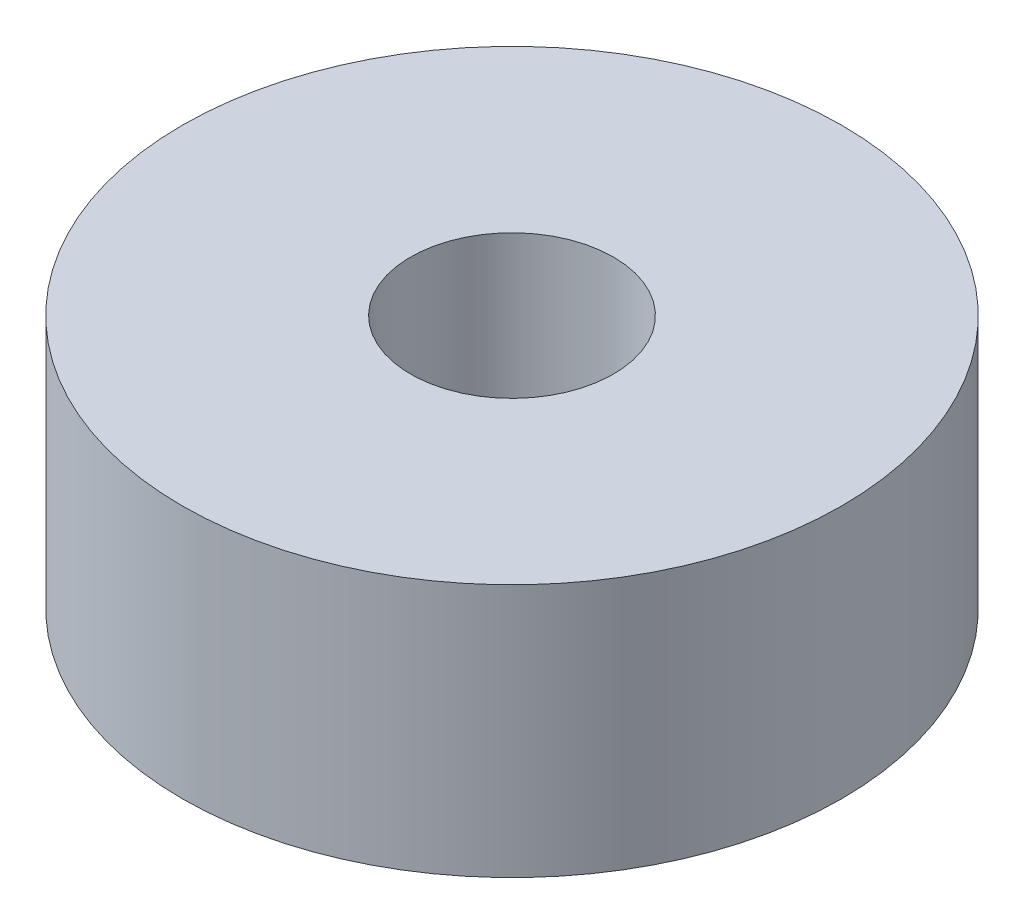
from build123d import *

# Parameters (mm, degrees)
ESQUISSE1_W = 4.5
ESQUISSE1_H = 5


with BuildPart() as part:
    # Esquisse1 → Révolution1 (revolve)
    with BuildSketch(Plane.XY, mode=Mode.PRIVATE) as r_volution1_sk:
        with Locations((4.25, 0)):
            Rectangle(ESQUISSE1_W, ESQUISSE1_H)
    revolve(r_volution1_sk.sketch.rotate(Axis((0, -2.39881159, 0), (0, 1, 0)), 90), axis=Axis((0, -2.39881159, 0), (0, 1, 0)))


solid = part.part
